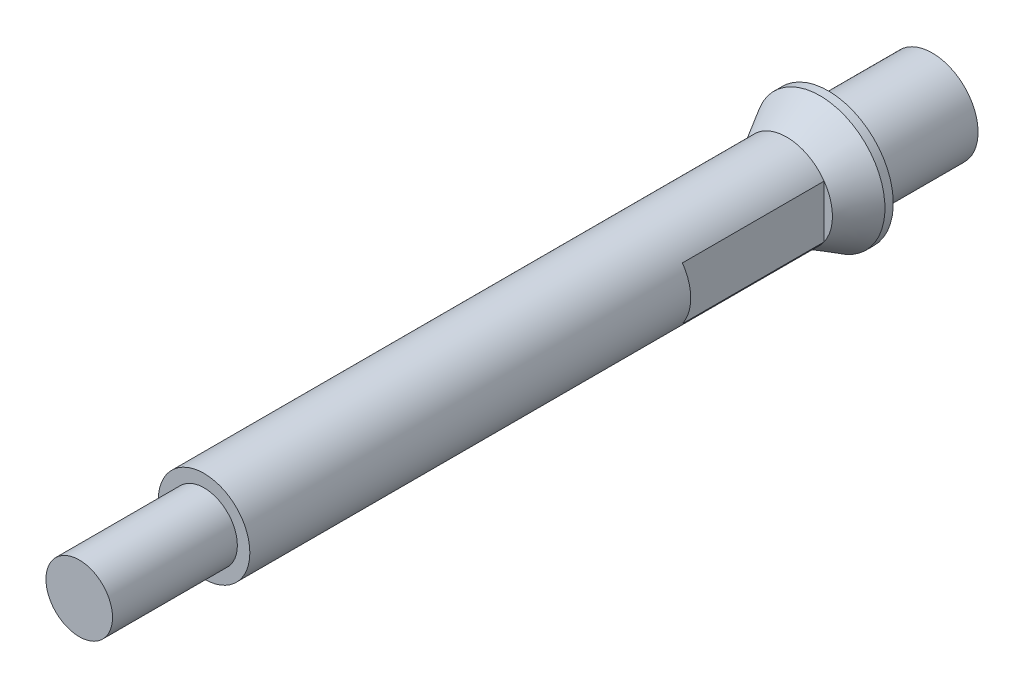
from build123d import *

# Parameters (mm, degrees)
SKETCH1_R           = 11
BOSS_EXTRUDE1_DEPTH = 140
SKETCH2_R           = 8
BOSS_EXTRUDE2_DEPTH = 30
SKETCH3_R           = 11
BOSS_EXTRUDE3_DEPTH = 8
BOSS_EXTRUDE3_DRAFT = -30
SKETCH4_R           = 15.618802154
BOSS_EXTRUDE4_DEPTH = 2
SKETCH5_W           = 34.053216137
SKETCH5_H           = 15
CUT_EXTRUDE1_DEPTH  = 2
BOSS_EXTRUDE5_START = 25
SKETCH6_R           = 11
BOSS_EXTRUDE5_DEPTH = 25


with BuildPart() as part:
    # Sketch1 → Boss-Extrude1 (new body)
    with BuildSketch(Plane.XY):
        Circle(SKETCH1_R)
    extrude(amount=BOSS_EXTRUDE1_DEPTH)

    # Sketch2 → Boss-Extrude2 (add)
    with BuildSketch(Plane.XY.offset(140)):
        Circle(SKETCH2_R)
    extrude(amount=BOSS_EXTRUDE2_DEPTH)


with BuildPart() as boss_extrude3_tool:
    # Sketch3 → Boss-Extrude3 (with draft: the straight prism first)
    with BuildSketch(Plane(origin=(0, 0, 0), x_dir=(-1, 0, 0), z_dir=(0, 0, -1))):
        Circle(SKETCH3_R)
    extrude(amount=BOSS_EXTRUDE3_DEPTH)
    # Boss-Extrude3: the draft: its side faces are tilted about the plane it starts from
    boss_extrude3_sides = [boss_extrude3_tool.faces().sort_by_distance(p)[0] for p in [
        (11, 0, -4),
    ]]
    draft(boss_extrude3_sides, Plane(origin=(0, 0, 0), x_dir=(-1, 0, 0), z_dir=(0, 0, -1)), BOSS_EXTRUDE3_DRAFT)


with BuildPart() as part_1:
    add(part.part)

    # Boss-Extrude3: add boss_extrude3_tool
    add(boss_extrude3_tool.part)

    # Sketch4 → Boss-Extrude4 (add)
    with BuildSketch(Plane(origin=(0, 0, -8), x_dir=(-1, 0, 0), z_dir=(0, 0, -1))):
        Circle(SKETCH4_R)
    extrude(amount=BOSS_EXTRUDE4_DEPTH)

    # Sketch5 → Cut-Extrude1 (cut)
    with BuildSketch(Plane.ZY.offset(11)):
        with Locations((17.026608068, 0)):
            Rectangle(SKETCH5_W, SKETCH5_H)
    cut_extrude1 = extrude(amount=-CUT_EXTRUDE1_DEPTH, mode=Mode.SUBTRACT)

    # Mirror1: Cut-Extrude1 across plane
    add(cut_extrude1.mirror(Plane(origin=(0, 0, 0), x_dir=(0, 0, 1), z_dir=(1, 0, 0))), mode=Mode.SUBTRACT)

    # Sketch6 → Boss-Extrude5 (add)
    with BuildSketch(Plane(origin=(0, 0, -10), x_dir=(-1, 0, 0), z_dir=(0, 0, -1)).offset(BOSS_EXTRUDE5_START)):
        with Locations(Location((0, 0, 0), (0, 0, 35.096801228))):
            Circle(SKETCH6_R)
    extrude(amount=-BOSS_EXTRUDE5_DEPTH)


solid = part_1.part
